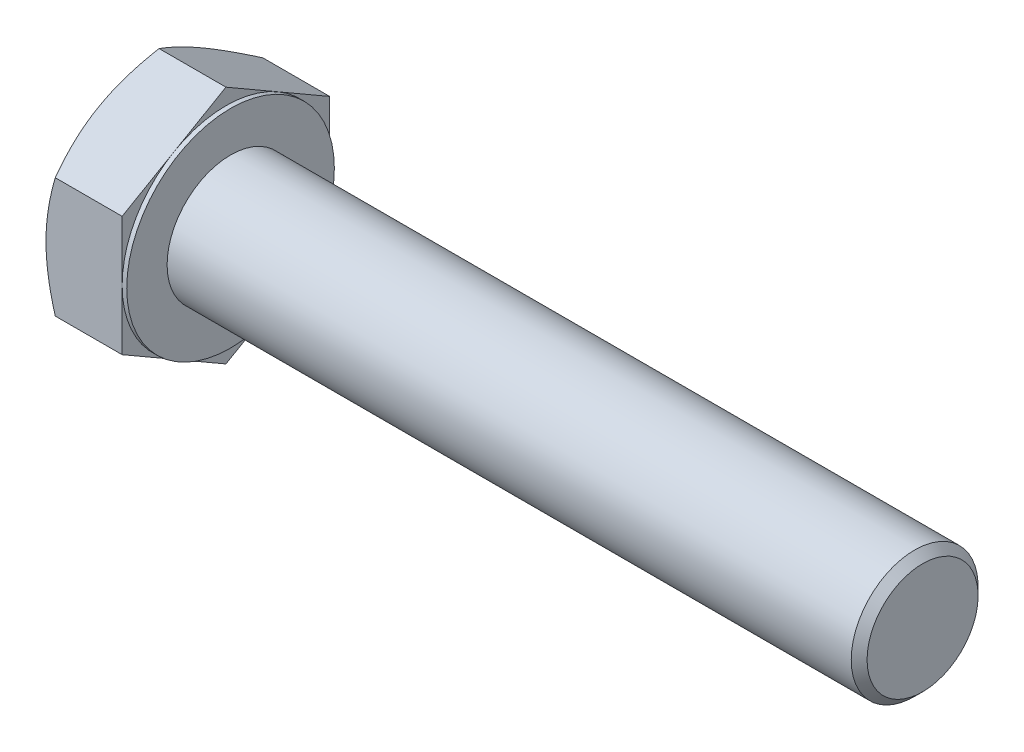
from build123d import *

# Parameters (mm, degrees)
BASEHEAD_DEPTH = 14
SKETCH4_W      = 0.8
SKETCH4_H      = 12.784609691


with BuildPart() as part:
    # Sketch1 → BaseHead (new body)
    with BuildSketch(Plane(origin=(0, 0, 0), x_dir=(0, 0, -1), z_dir=(1, 0, 0))):
        Polygon((18, 10.392304845), (18, -10.392304845), (0, -20.784609691), (-18, -10.392304845), (-18, 10.392304845), (0, 20.784609691), align=None)
    extrude(amount=BASEHEAD_DEPTH)

    # BodySke → BaseBody (revolve)
    with BuildSketch(Plane.XY, mode=Mode.PRIVATE) as basebody_sk:
        Polygon((0, 0), (134, 0), (134, 9.626), (132.626, 11), (0, 11), align=None)
    revolve(basebody_sk.sketch.rotate(Axis((0, 0, 0), (1, 0, 0)), 90), axis=Axis((0, 0, 0), (1, 0, 0)))

    # Sketch3 → HeadChamfer (revolve, cut)
    with BuildSketch(Plane.XY):
        Polygon((0, 18), (4.494446501, 25.784609691), (4.494446501, 30.784609691), (-10, 30.784609691), (-10, 18), align=None)
    revolve(axis=Axis((0, 0, 0), (1, 0, 0)), mode=Mode.SUBTRACT)

    # Sketch4 → BearingFace (revolve, cut)
    with BuildSketch(Plane.XY, mode=Mode.PRIVATE) as bearingface_sk:
        with Locations((13.6, 24.392304845)):
            Rectangle(SKETCH4_W, SKETCH4_H)
    revolve(bearingface_sk.sketch.rotate(Axis((0, 0, 0), (1, 0, 0)), 270), axis=Axis((0, 0, 0), (1, 0, 0)), mode=Mode.SUBTRACT)


solid = part.part
